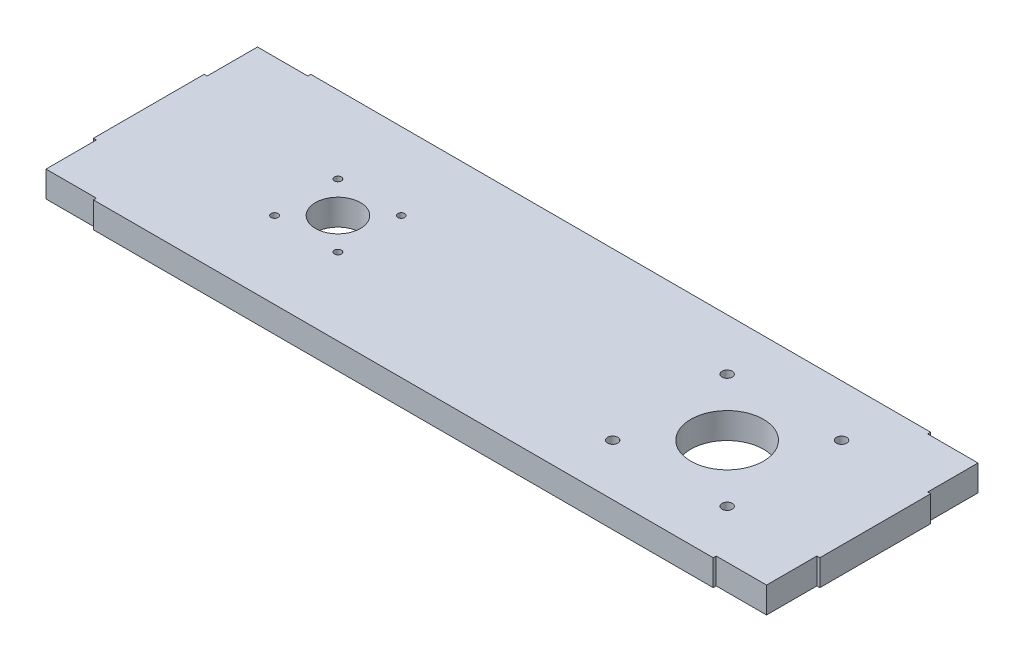
from build123d import *

# Parameters (mm, degrees)
BOSS_EXTRUDE1_DEPTH = 12.7
CUT_EXTRUDE1_REACH  = 188.026
SKETCH2_R           = 2.5
SKETCH2_R_2         = 17.78
SKETCH2_R_3         = 11
SKETCH2_R_4         = 1.7


with BuildPart() as part:
    # Sketch1 → Boss-Extrude1 (new body)
    with BuildSketch(Plane(origin=(0, 0, 0), x_dir=(1, 0, 0), z_dir=(0, 1, 0))):
        Polygon((151.7015, 53.213), (151.7015, 51.7525), (176.3395, 51.7525), (176.3395, 27.1145), (177.8, 27.1145), (177.8, -27.1145), (176.3395, -27.1145), (176.3395, -51.7525), (151.7015, -51.7525), (151.7015, -53.213), (-151.7015, -53.213), (-151.7015, -51.7525), (-176.3395, -51.7525), (-176.3395, -27.1145), (-177.8, -27.1145), (-177.8, 27.1145), (-176.3395, 27.1145), (-176.3395, 51.7525), (-151.7015, 51.7525), (-151.7015, 53.213), align=None)
    extrude(amount=BOSS_EXTRUDE1_DEPTH)

    # Sketch2 → Cut-Extrude1 (cut, up to next)
    with BuildSketch(Plane(origin=(0, 12.7, 0), x_dir=(1, 0, 0), z_dir=(0, 1, 0)), mode=Mode.PRIVATE) as cut_extrude1_sk1:
        with Locations(Location((133.3, -28, 0), (0, 0, 270))):
            Circle(SKETCH2_R)
    cut_extrude1_tool1 = extrude(cut_extrude1_sk1.sketch, amount=-CUT_EXTRUDE1_REACH, mode=Mode.PRIVATE) & part.part
    # Sketch2 → Cut-Extrude1 (cut, up to next)
    with BuildSketch(Plane(origin=(0, 12.7, 0), x_dir=(1, 0, 0), z_dir=(0, 1, 0)), mode=Mode.PRIVATE) as cut_extrude1_sk2:
        with Locations(Location((77.3, -28, 0), (0, 0, 90))):
            Circle(SKETCH2_R)
    cut_extrude1_tool2 = extrude(cut_extrude1_sk2.sketch, amount=-CUT_EXTRUDE1_REACH, mode=Mode.PRIVATE) & part.part
    # Sketch2 → Cut-Extrude1 (cut, up to next)
    with BuildSketch(Plane(origin=(0, 12.7, 0), x_dir=(1, 0, 0), z_dir=(0, 1, 0)), mode=Mode.PRIVATE) as cut_extrude1_sk3:
        with Locations(Location((133.3, 28, 0), (0, 0, 90))):
            Circle(SKETCH2_R)
    cut_extrude1_tool3 = extrude(cut_extrude1_sk3.sketch, amount=-CUT_EXTRUDE1_REACH, mode=Mode.PRIVATE) & part.part
    # Sketch2 → Cut-Extrude1 (cut, up to next)
    with BuildSketch(Plane(origin=(0, 12.7, 0), x_dir=(1, 0, 0), z_dir=(0, 1, 0)), mode=Mode.PRIVATE) as cut_extrude1_sk4:
        with Locations(Location((77.3, 28, 0), (0, 0, 270))):
            Circle(SKETCH2_R)
    cut_extrude1_tool4 = extrude(cut_extrude1_sk4.sketch, amount=-CUT_EXTRUDE1_REACH, mode=Mode.PRIVATE) & part.part
    # Sketch2 → Cut-Extrude1 (cut, up to next)
    with BuildSketch(Plane(origin=(0, 12.7, 0), x_dir=(1, 0, 0), z_dir=(0, 1, 0)), mode=Mode.PRIVATE) as cut_extrude1_sk5:
        with Locations(Location((105.3, 0, 0), (0, 0, 270))):
            Circle(SKETCH2_R_2)
    cut_extrude1_tool5 = extrude(cut_extrude1_sk5.sketch, amount=-CUT_EXTRUDE1_REACH, mode=Mode.PRIVATE) & part.part
    # Sketch2 → Cut-Extrude1 (cut, up to next)
    with BuildSketch(Plane(origin=(0, 12.7, 0), x_dir=(1, 0, 0), z_dir=(0, 1, 0)), mode=Mode.PRIVATE) as cut_extrude1_sk6:
        with Locations(Location((-85.2, 0, 0), (0, 0, 270))):
            Circle(SKETCH2_R_3)
    cut_extrude1_tool6 = extrude(cut_extrude1_sk6.sketch, amount=-CUT_EXTRUDE1_REACH, mode=Mode.PRIVATE) & part.part
    # Sketch2 → Cut-Extrude1 (cut, up to next)
    with BuildSketch(Plane(origin=(0, 12.7, 0), x_dir=(1, 0, 0), z_dir=(0, 1, 0)), mode=Mode.PRIVATE) as cut_extrude1_sk7:
        with Locations(Location((-100.7, 15.5, 0), (0, 0, 270))):
            Circle(SKETCH2_R_4)
    cut_extrude1_tool7 = extrude(cut_extrude1_sk7.sketch, amount=-CUT_EXTRUDE1_REACH, mode=Mode.PRIVATE) & part.part
    # Sketch2 → Cut-Extrude1 (cut, up to next)
    with BuildSketch(Plane(origin=(0, 12.7, 0), x_dir=(1, 0, 0), z_dir=(0, 1, 0)), mode=Mode.PRIVATE) as cut_extrude1_sk8:
        with Locations(Location((-69.7, 15.5, 0), (0, 0, 90))):
            Circle(SKETCH2_R_4)
    cut_extrude1_tool8 = extrude(cut_extrude1_sk8.sketch, amount=-CUT_EXTRUDE1_REACH, mode=Mode.PRIVATE) & part.part
    # Sketch2 → Cut-Extrude1 (cut, up to next)
    with BuildSketch(Plane(origin=(0, 12.7, 0), x_dir=(1, 0, 0), z_dir=(0, 1, 0)), mode=Mode.PRIVATE) as cut_extrude1_sk9:
        with Locations(Location((-69.7, -15.5, 0), (0, 0, 270))):
            Circle(SKETCH2_R_4)
    cut_extrude1_tool9 = extrude(cut_extrude1_sk9.sketch, amount=-CUT_EXTRUDE1_REACH, mode=Mode.PRIVATE) & part.part
    # Sketch2 → Cut-Extrude1 (cut, up to next)
    with BuildSketch(Plane(origin=(0, 12.7, 0), x_dir=(1, 0, 0), z_dir=(0, 1, 0)), mode=Mode.PRIVATE) as cut_extrude1_sk10:
        with Locations(Location((-100.7, -15.5, 0), (0, 0, 90))):
            Circle(SKETCH2_R_4)
    cut_extrude1_tool10 = extrude(cut_extrude1_sk10.sketch, amount=-CUT_EXTRUDE1_REACH, mode=Mode.PRIVATE) & part.part
    add(cut_extrude1_tool1.solids().sort_by_distance((133.3, 12.7, 28))[0], mode=Mode.SUBTRACT)
    add(cut_extrude1_tool2.solids().sort_by_distance((77.3, 12.7, 28))[0], mode=Mode.SUBTRACT)
    add(cut_extrude1_tool3.solids().sort_by_distance((133.3, 12.7, -28))[0], mode=Mode.SUBTRACT)
    add(cut_extrude1_tool4.solids().sort_by_distance((77.3, 12.7, -28))[0], mode=Mode.SUBTRACT)
    add(cut_extrude1_tool5.solids().sort_by_distance((105.3, 12.7, 0))[0], mode=Mode.SUBTRACT)
    add(cut_extrude1_tool6.solids().sort_by_distance((-85.2, 12.7, 0))[0], mode=Mode.SUBTRACT)
    add(cut_extrude1_tool7.solids().sort_by_distance((-100.7, 12.7, -15.5))[0], mode=Mode.SUBTRACT)
    add(cut_extrude1_tool8.solids().sort_by_distance((-69.7, 12.7, -15.5))[0], mode=Mode.SUBTRACT)
    add(cut_extrude1_tool9.solids().sort_by_distance((-69.7, 12.7, 15.5))[0], mode=Mode.SUBTRACT)
    add(cut_extrude1_tool10.solids().sort_by_distance((-100.7, 12.7, 15.5))[0], mode=Mode.SUBTRACT)


solid = part.part
